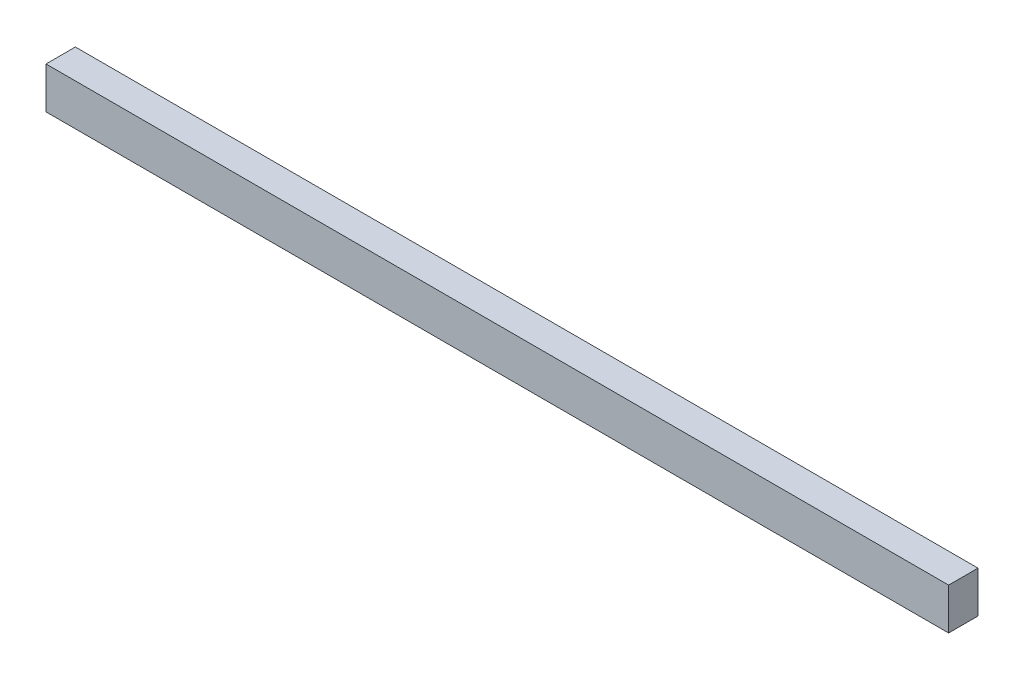
from build123d import *

# Parameters (mm, degrees)
SKETCH1_W           = 552.45
SKETCH1_H           = 25.4
BOSS_EXTRUDE1_DEPTH = 17.9832


with BuildPart() as part:
    # Sketch1 → Boss-Extrude1 (new body)
    with BuildSketch(Plane.XY):
        Rectangle(SKETCH1_W, SKETCH1_H)
    extrude(amount=BOSS_EXTRUDE1_DEPTH)


solid = part.part
